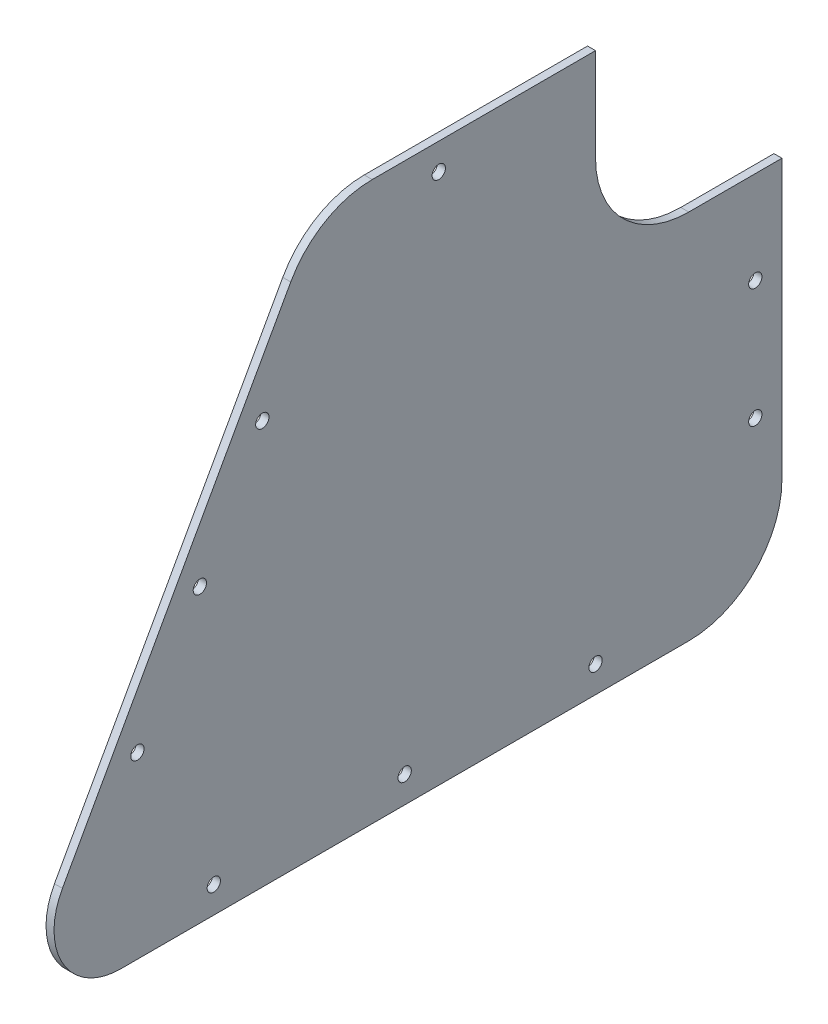
from build123d import *

# Parameters (mm, degrees)
BOSS_EXTRUDE1_DEPTH = 3
CUT_EXTRUDE1_REACH  = 242.652
SKETCH2_R           = 2.5
CUT_EXTRUDE2_REACH  = 242.652


with BuildPart() as part:
    # Sketch1 → Boss-Extrude1 (new body)
    with BuildSketch(Plane(origin=(0, 0, 0), x_dir=(0, 0, -1), z_dir=(1, 0, 0))):
        with BuildLine():
            Line((-12.188515962, 194.5), (106.683660563, 194.5))
            ThreePointArc((106.683660563, 194.5), (131.432397904, 184.248737342), (141.683660563, 159.5))
            Line((141.683660563, 159.5), (141.683660563, 20))
            ThreePointArc((141.683660563, 20), (131.432397904, -4.748737342), (106.683660563, -15))
            Line((106.683660563, -15), (-106.683660563, -15))
            ThreePointArc((-106.683660563, -15), (-128.230433314, -2.678193247), (-128.537592466, 22.141073279))
            Line((-128.537592466, 22.141073279), (-42.784020626, 176.497502591))
            ThreePointArc((-42.784020626, 176.497502591), (-29.937986507, 189.665481852), (-12.188515962, 194.5))
        make_face()
    extrude(amount=BOSS_EXTRUDE1_DEPTH)

    # Sketch2 → Cut-Extrude1 (cut, up to next)
    with BuildSketch(Plane(origin=(3, 0, 0), x_dir=(0, 0, -1), z_dir=(1, 0, 0)), mode=Mode.PRIVATE) as cut_extrude1_sk1:
        with Locations((81.683660563, 184.5)):
            Circle(SKETCH2_R)
    cut_extrude1_tool1 = extrude(cut_extrude1_sk1.sketch, amount=-CUT_EXTRUDE1_REACH, mode=Mode.PRIVATE) & part.part
    # Sketch2 → Cut-Extrude1 (cut, up to next)
    with BuildSketch(Plane(origin=(3, 0, 0), x_dir=(0, 0, -1), z_dir=(1, 0, 0)), mode=Mode.PRIVATE) as cut_extrude1_sk2:
        with Locations((12.811484038, 184.5)):
            Circle(SKETCH2_R)
    cut_extrude1_tool2 = extrude(cut_extrude1_sk2.sketch, amount=-CUT_EXTRUDE1_REACH, mode=Mode.PRIVATE) & part.part
    # Sketch2 → Cut-Extrude1 (cut, up to next)
    with BuildSketch(Plane(origin=(3, 0, 0), x_dir=(0, 0, -1), z_dir=(1, 0, 0)), mode=Mode.PRIVATE) as cut_extrude1_sk3:
        with Locations((131.683660563, 134.49995686)):
            Circle(SKETCH2_R)
    cut_extrude1_tool3 = extrude(cut_extrude1_sk3.sketch, amount=-CUT_EXTRUDE1_REACH, mode=Mode.PRIVATE) & part.part
    # Sketch2 → Cut-Extrude1 (cut, up to next)
    with BuildSketch(Plane(origin=(3, 0, 0), x_dir=(0, 0, -1), z_dir=(1, 0, 0)), mode=Mode.PRIVATE) as cut_extrude1_sk4:
        with Locations((131.683660563, 89.75)):
            Circle(SKETCH2_R)
    cut_extrude1_tool4 = extrude(cut_extrude1_sk4.sketch, amount=-CUT_EXTRUDE1_REACH, mode=Mode.PRIVATE) & part.part
    # Sketch2 → Cut-Extrude1 (cut, up to next)
    with BuildSketch(Plane(origin=(3, 0, 0), x_dir=(0, 0, -1), z_dir=(1, 0, 0)), mode=Mode.PRIVATE) as cut_extrude1_sk5:
        with Locations((131.683660563, 44.999939605)):
            Circle(SKETCH2_R)
    cut_extrude1_tool5 = extrude(cut_extrude1_sk5.sketch, amount=-CUT_EXTRUDE1_REACH, mode=Mode.PRIVATE) & part.part
    # Sketch2 → Cut-Extrude1 (cut, up to next)
    with BuildSketch(Plane(origin=(3, 0, 0), x_dir=(0, 0, -1), z_dir=(1, 0, 0)), mode=Mode.PRIVATE) as cut_extrude1_sk6:
        with Locations((71.683660563, -5)):
            Circle(SKETCH2_R)
    cut_extrude1_tool6 = extrude(cut_extrude1_sk6.sketch, amount=-CUT_EXTRUDE1_REACH, mode=Mode.PRIVATE) & part.part
    # Sketch2 → Cut-Extrude1 (cut, up to next)
    with BuildSketch(Plane(origin=(3, 0, 0), x_dir=(0, 0, -1), z_dir=(1, 0, 0)), mode=Mode.PRIVATE) as cut_extrude1_sk7:
        with Locations((0, -5)):
            Circle(SKETCH2_R)
    cut_extrude1_tool7 = extrude(cut_extrude1_sk7.sketch, amount=-CUT_EXTRUDE1_REACH, mode=Mode.PRIVATE) & part.part
    # Sketch2 → Cut-Extrude1 (cut, up to next)
    with BuildSketch(Plane(origin=(3, 0, 0), x_dir=(0, 0, -1), z_dir=(1, 0, 0)), mode=Mode.PRIVATE) as cut_extrude1_sk8:
        with Locations((-71.683660563, -5)):
            Circle(SKETCH2_R)
    cut_extrude1_tool8 = extrude(cut_extrude1_sk8.sketch, amount=-CUT_EXTRUDE1_REACH, mode=Mode.PRIVATE) & part.part
    # Sketch2 → Cut-Extrude1 (cut, up to next)
    with BuildSketch(Plane(origin=(3, 0, 0), x_dir=(0, 0, -1), z_dir=(1, 0, 0)), mode=Mode.PRIVATE) as cut_extrude1_sk9:
        with Locations((-100.370302458, 52.250935013)):
            Circle(SKETCH2_R)
    cut_extrude1_tool9 = extrude(cut_extrude1_sk9.sketch, amount=-CUT_EXTRUDE1_REACH, mode=Mode.PRIVATE) & part.part
    # Sketch2 → Cut-Extrude1 (cut, up to next)
    with BuildSketch(Plane(origin=(3, 0, 0), x_dir=(0, 0, -1), z_dir=(1, 0, 0)), mode=Mode.PRIVATE) as cut_extrude1_sk10:
        with Locations((-76.919233785, 94.462858624)):
            Circle(SKETCH2_R)
    cut_extrude1_tool10 = extrude(cut_extrude1_sk10.sketch, amount=-CUT_EXTRUDE1_REACH, mode=Mode.PRIVATE) & part.part
    # Sketch2 → Cut-Extrude1 (cut, up to next)
    with BuildSketch(Plane(origin=(3, 0, 0), x_dir=(0, 0, -1), z_dir=(1, 0, 0)), mode=Mode.PRIVATE) as cut_extrude1_sk11:
        with Locations((-53.468165112, 136.674782235)):
            Circle(SKETCH2_R)
    cut_extrude1_tool11 = extrude(cut_extrude1_sk11.sketch, amount=-CUT_EXTRUDE1_REACH, mode=Mode.PRIVATE) & part.part
    add(cut_extrude1_tool1.solids().sort_by_distance((3, 184.5, -81.683661))[0], mode=Mode.SUBTRACT)
    add(cut_extrude1_tool2.solids().sort_by_distance((3, 184.5, -12.811484))[0], mode=Mode.SUBTRACT)
    add(cut_extrude1_tool3.solids().sort_by_distance((3, 134.499957, -131.683661))[0], mode=Mode.SUBTRACT)
    add(cut_extrude1_tool4.solids().sort_by_distance((3, 89.75, -131.683661))[0], mode=Mode.SUBTRACT)
    add(cut_extrude1_tool5.solids().sort_by_distance((3, 44.99994, -131.683661))[0], mode=Mode.SUBTRACT)
    add(cut_extrude1_tool6.solids().sort_by_distance((3, -5, -71.683661))[0], mode=Mode.SUBTRACT)
    add(cut_extrude1_tool7.solids().sort_by_distance((3, -5, 0))[0], mode=Mode.SUBTRACT)
    add(cut_extrude1_tool8.solids().sort_by_distance((3, -5, 71.683661))[0], mode=Mode.SUBTRACT)
    add(cut_extrude1_tool9.solids().sort_by_distance((3, 52.250935, 100.370302))[0], mode=Mode.SUBTRACT)
    add(cut_extrude1_tool10.solids().sort_by_distance((3, 94.462859, 76.919234))[0], mode=Mode.SUBTRACT)
    add(cut_extrude1_tool11.solids().sort_by_distance((3, 136.674782, 53.468165))[0], mode=Mode.SUBTRACT)

    # Sketch3 → Cut-Extrude2 (cut, up to next)
    with BuildSketch(Plane(origin=(3, 0, 0), x_dir=(0, 0, -1), z_dir=(1, 0, 0)), mode=Mode.PRIVATE) as cut_extrude2_sk1:
        with BuildLine():
            Line((71.683660563, 159.5), (71.683660563, 194.5))
            Line((71.683660563, 194.5), (106.683660563, 194.5))
            ThreePointArc((106.683660563, 194.5), (131.432397904, 184.248737342), (141.683660563, 159.5))
            Line((141.683660563, 159.5), (141.683660563, 124.5))
            Line((141.683660563, 124.5), (106.683660563, 124.5))
            ThreePointArc((106.683660563, 124.5), (81.934923221, 134.751262658), (71.683660563, 159.5))
        make_face()
    cut_extrude2_tool1 = extrude(cut_extrude2_sk1.sketch, amount=-CUT_EXTRUDE2_REACH, mode=Mode.PRIVATE) & part.part
    add(cut_extrude2_tool1.solids().sort_by_distance((3, 159.5, -106.683661))[0], mode=Mode.SUBTRACT)


solid = part.part
